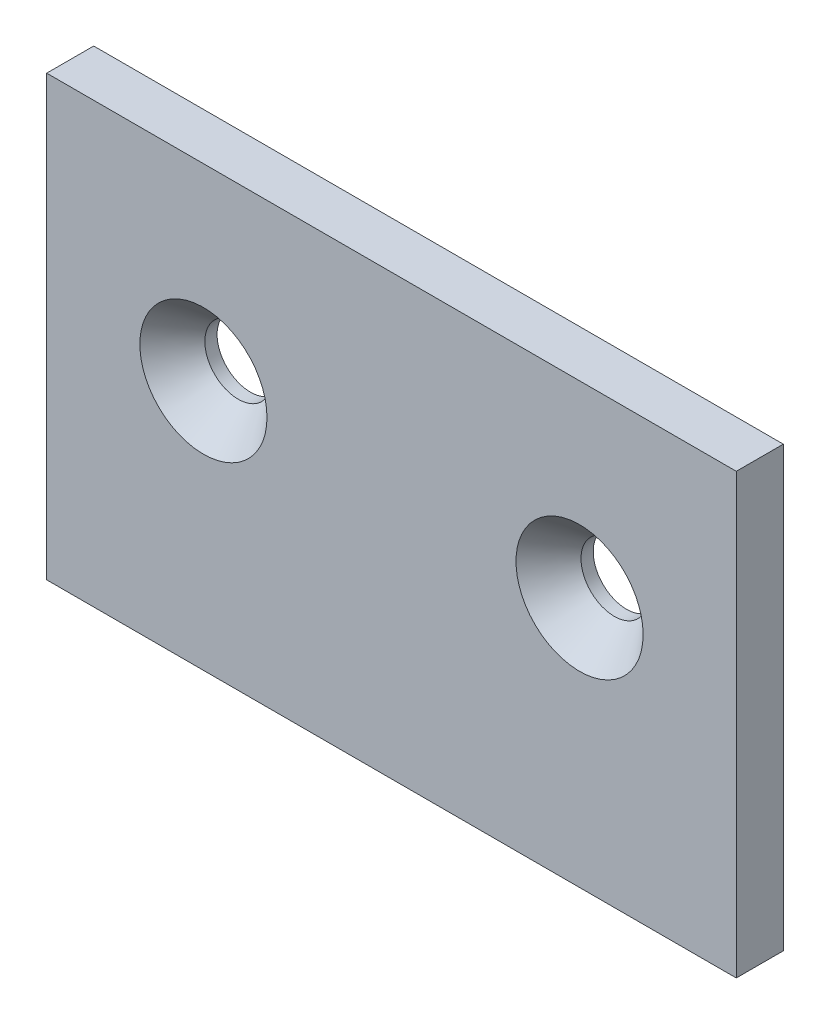
from build123d import *

# Parameters (mm, degrees)
CROQUIS1_W                                  = 69.85
CROQUIS1_H                                  = 44.45
SALIENTE_EXTRUIR1_DEPTH                     = 4.7625
AVELLANADO_PARA_TORNILLO_CON_CABEZA_2_COUNT = 2
AVELLANADO_PARA_TORNILLO_CON_CABEZA_2_PITCH = 38.1


with BuildPart() as part:
    # Croquis1 → Saliente-Extruir1 (new body)
    with BuildSketch(Plane.XY):
        with Locations((34.925, 22.225)):
            Rectangle(CROQUIS1_W, CROQUIS1_H)
    extrude(amount=SALIENTE_EXTRUIR1_DEPTH)

    # Croquis3 → Avellanado para tornillo con cabeza ovalada de 1/41 (revolve, cut)
    with BuildSketch(Plane(origin=(53.975, 25.4, 4.7625), x_dir=(0, -1, 0), z_dir=(1, 0, 0))):
        Polygon((0, 0), (0, 4.7625), (3.3782, 4.7625), (3.3782, 3.520932584), (6.4389, 0), align=None)
    avellanado_para_tornillo_con_cabeza_oval = revolve(axis=Axis((53.975, 25.4, 11.1125), (0, 0, -1)), mode=Mode.SUBTRACT)

    # Avellanado para tornillo con cabeza  2: Avellanado para tornillo con cabeza ovalada de 1/41 ×2
    with Locations(*[(-i * AVELLANADO_PARA_TORNILLO_CON_CABEZA_2_PITCH, 0, 0) for i in range(1, AVELLANADO_PARA_TORNILLO_CON_CABEZA_2_COUNT)]):
        add(avellanado_para_tornillo_con_cabeza_oval, mode=Mode.SUBTRACT)


solid = part.part
